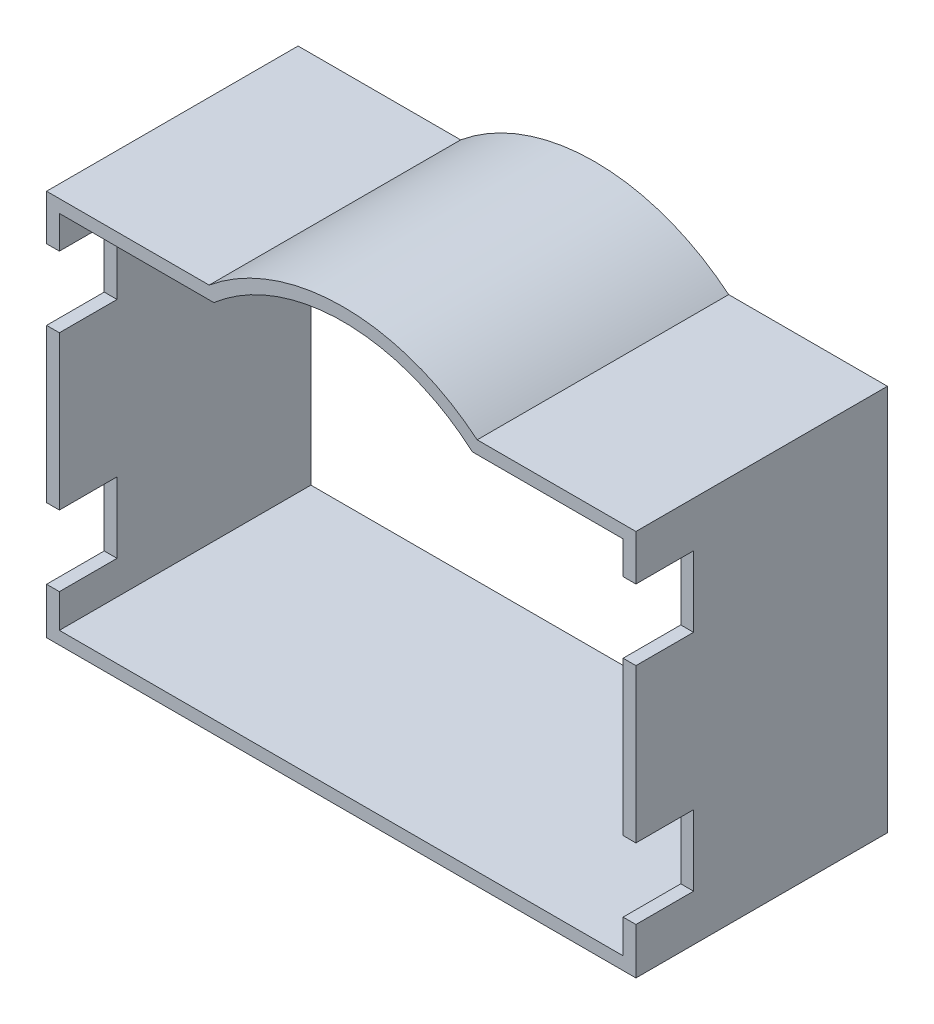
from build123d import *

# Parameters (mm, degrees)
BOSS_EXTRUDE2_DEPTH = 49.8602
SHELL2_T            = 2.54
SKETCH4_W           = 2.54
SKETCH4_H           = 14.004037607
SKETCH4_H_2         = 14.000022482
SKETCH4_H_3         = 14.004058035
CUT_EXTRUDE1_DEPTH  = 11.43


with BuildPart() as part:
    # Sketch2 → Boss-Extrude2 (new body)
    with BuildSketch(Plane.XY):
        with BuildLine():
            Line((20.510960331, 69.60596379), (50.371443222, 69.60596379))
            Line((50.371443222, 69.60596379), (50.371443222, -1.977240525))
            Line((50.371443222, -1.977240525), (-61.38356009, -1.977240525))
            Line((-61.38356009, -1.977240525), (-61.38356009, 69.60596379))
            Line((-61.38356009, 69.60596379), (-30.761077997, 69.60596379))
            ThreePointArc((-30.761077997, 69.60596379), (-5.125058833, 79.163961442), (20.510960331, 69.60596379))
        make_face()
    extrude(amount=BOSS_EXTRUDE2_DEPTH)

    # Shell2
    shell2_openings = [part.faces().sort_by_distance(p)[0] for p in [
        (-5.490717903, 35.411141446, 0),
        (-5.490717903, 35.411141446, 49.8602),
    ]]
    offset(amount=SHELL2_T, openings=shell2_openings, kind=Kind.INTERSECTION)

    # Sketch4 → Cut-Extrude1 (cut)
    with BuildSketch(Plane.XY.offset(49.8602)):
        with Locations((-62.65356009, 56.116943469)):
            Rectangle(SKETCH4_W, SKETCH4_H)
        with Locations((-62.65356009, 11.668972532)):
            Rectangle(SKETCH4_W, SKETCH4_H_2)
        with Locations((51.641443222, 56.116953683)):
            Rectangle(SKETCH4_W, SKETCH4_H_3)
        with Locations((51.641443222, 11.668972532)):
            Rectangle(SKETCH4_W, SKETCH4_H_2)
    extrude(amount=-CUT_EXTRUDE1_DEPTH, mode=Mode.SUBTRACT)


solid = part.part
